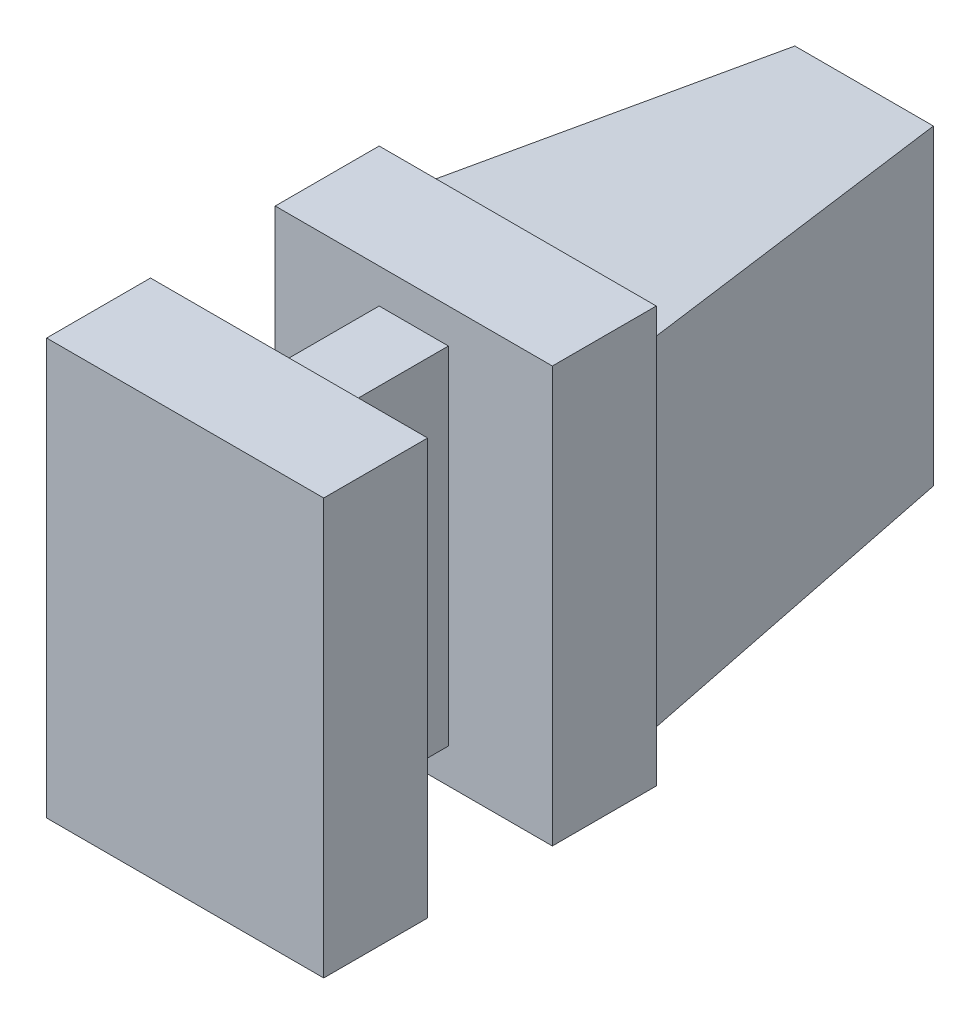
from build123d import *

# Parameters (mm, degrees)
SKETCH_2_W      = 1
SKETCH_2_H      = 5
EXTRUDE_1_DEPTH = 1.8
SKETCH_3_W      = 4
SKETCH_3_H      = 6
EXTRUDE_2_DEPTH = 1.5


with BuildPart() as part:
    # 草圖2 → 伸長1 (new body)
    with BuildSketch(Plane.XY):
        Rectangle(SKETCH_2_W, SKETCH_2_H)
    extrude(amount=EXTRUDE_1_DEPTH)

    # 草圖3 → 伸長2 (add)
    with BuildSketch(Plane(origin=(0, 0, 0), x_dir=(-1, 0, 0), z_dir=(0, 0, -1))):
        Rectangle(SKETCH_3_W, SKETCH_3_H)
    extrude_2 = extrude(amount=EXTRUDE_2_DEPTH)

    # 鏡射1: 伸長2 across plane
    add(extrude_2.mirror(Plane.XY.offset(0.9)))

    # 草圖4 → 疊層拉伸1 section 0
    with BuildSketch(Plane(origin=(0, 0, -6.5), x_dir=(-1, 0, 0), z_dir=(0, 0, -1))):
        with BuildLine():
            Line((-1, 2.25), (1, 2.25))
            Line((1, 2.25), (1, -2.25))
            Line((1, -2.25), (-1, -2.25))
            Line((-1, -2.25), (-1, 2.25))
        make_face()
    # 草圖5 → 疊層拉伸1 section 1
    with BuildSketch(Plane(origin=(0, 0, -1.5), x_dir=(-1, 0, 0), z_dir=(0, 0, -1))):
        with BuildLine():
            Line((-1.85, 2.45), (1.85, 2.45))
            Line((1.85, 2.45), (1.85, -2.45))
            Line((1.85, -2.45), (-1.85, -2.45))
            Line((-1.85, -2.45), (-1.85, 2.45))
        make_face()
    loft()


solid = part.part
